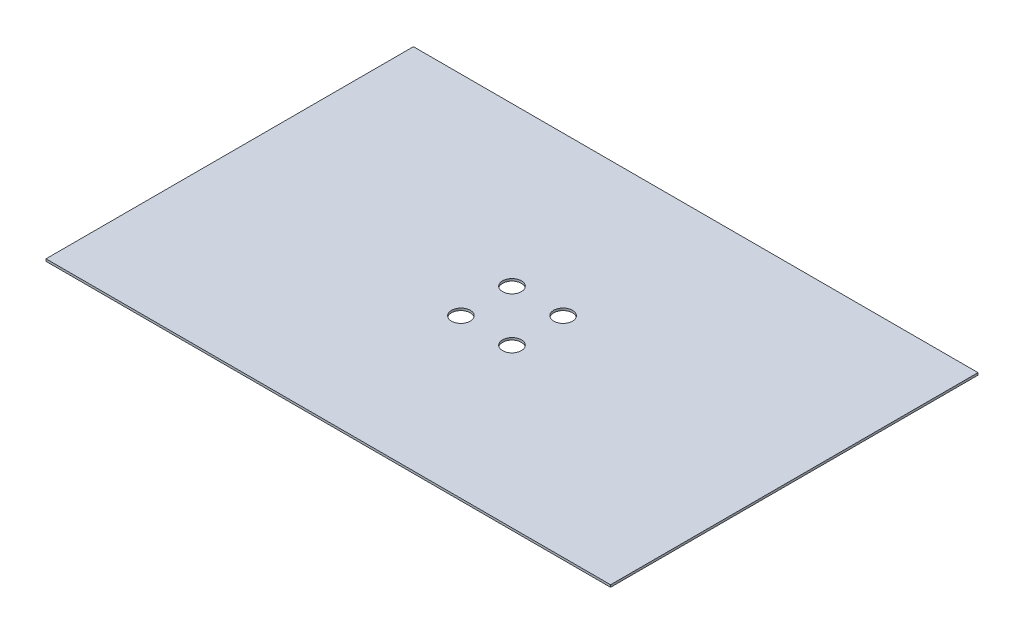
from build123d import *

# Parameters (mm, degrees)
SKETCH1_W           = 1260
SKETCH1_H           = 820
SKETCH1_R           = 21
BOSS_EXTRUDE1_DEPTH = 5


with BuildPart() as part:
    # Sketch1 → Boss-Extrude1 (new body)
    with BuildSketch(Plane(origin=(0, 0, 0), x_dir=(1, 0, 0), z_dir=(0, 1, 0))):
        Rectangle(SKETCH1_W, SKETCH1_H)
        with Locations(Location((-57, 57, 0), (0, 0, 270))):
            Circle(SKETCH1_R, mode=Mode.SUBTRACT)
        with Locations(Location((57, 57, 0), (0, 0, 270))):
            Circle(SKETCH1_R, mode=Mode.SUBTRACT)
        with Locations(Location((57, -57, 0), (0, 0, 270))):
            Circle(SKETCH1_R, mode=Mode.SUBTRACT)
        with Locations(Location((-57, -57, 0), (0, 0, 270))):
            Circle(SKETCH1_R, mode=Mode.SUBTRACT)
    extrude(amount=BOSS_EXTRUDE1_DEPTH)


solid = part.part
